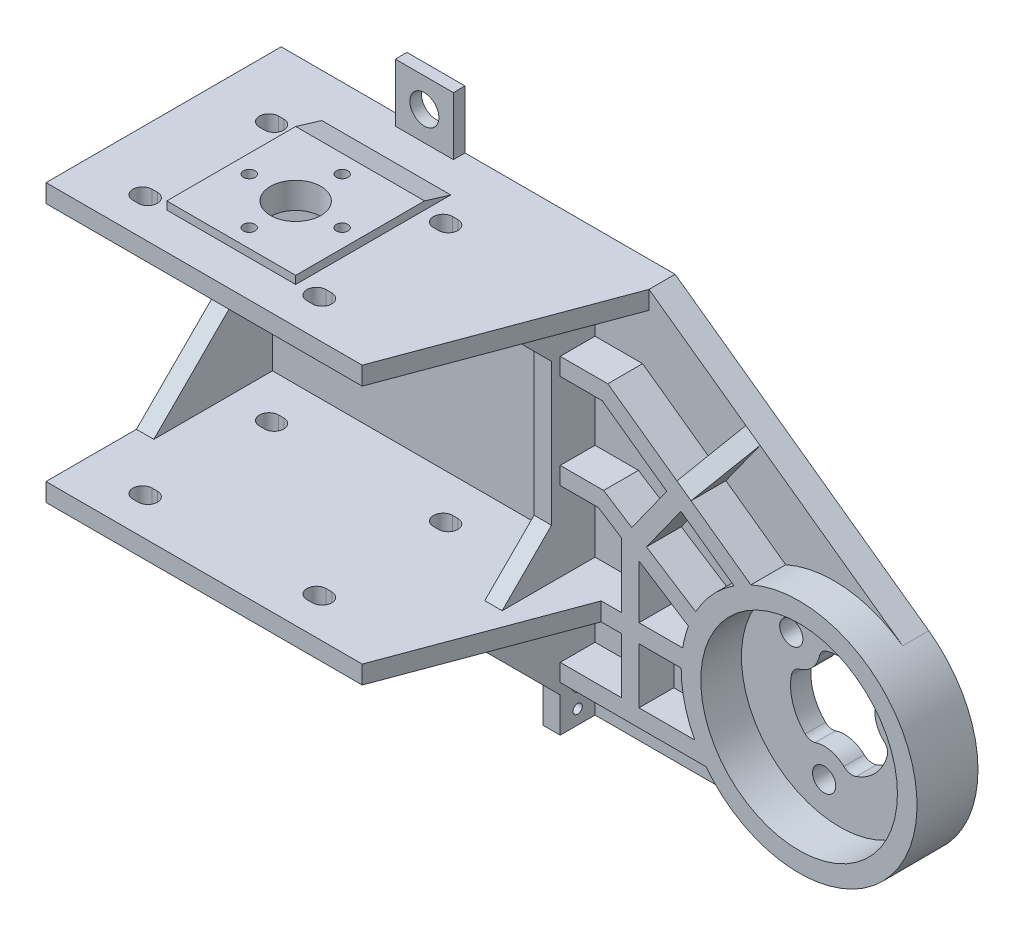
from build123d import *

# Parameters (mm, degrees)
SALIENTE_EXTRUIR1_DEPTH      = 3
SALIENTE_EXTRUIR1_DEPTH_BACK = 1.5
CROQUIS1_W                   = 121.063667988
CROQUIS1_H                   = 68.140715221
CROQUIS2_W                   = 67.847795658
CROQUIS2_H                   = 3.13
SALIENTE_EXTRUIR2_DEPTH      = 36
CORTAR_EXTRUIR1_REACH        = 128.318
SALIENTE_EXTRUIR3_DEPTH      = 3
CORTAR_EXTRUIR2_DEPTH        = 4.5
TALADRO_ROSCADO_M41_D        = 3.3
TALADRO_ROSCADO_M41_DEPTH    = 11.5
TALADRO_ROSCADO_M41_TIP      = 0.991420021
CROQUIS9_W                   = 10
CROQUIS9_H                   = 2
SALIENTE_EXTRUIR5_DEPTH      = 10
CROQUIS10_R                  = 2.5
CORTAR_EXTRUIR3_DEPTH        = 10
CROQUIS12_W                  = 22.2
CROQUIS12_H                  = 22.2
SALIENTE_EXTRUIR6_DEPTH      = 1.37
CROQUIS13_R                  = 1
CROQUIS13_R_2                = 4.35
CORTAR_EXTRUIR5_DEPTH        = 4.5
CROQUIS14_R                  = 2
CORTAR_EXTRUIR6_DEPTH        = 2
SALIENTE_EXTRUIR7_DEPTH      = 22.2
SALIENTE_EXTRUIR8_DEPTH      = 3
CROQUIS18_R                  = 20.310715222
CROQUIS18_R_2                = 16.935683112
SALIENTE_EXTRUIR9_DEPTH      = 6
CORTAR_EXTRUIR7_START        = -1
CROQUIS19_R                  = 16.935683112
CORTAR_EXTRUIR7_DEPTH        = 1
CROQUIS20_R                  = 8.480335769
CORTAR_EXTRUIR8_DEPTH        = 8
CROQUIS21_R                  = 2
CORTAR_EXTRUIR9_DEPTH        = 8
SALIENTE_EXTRUIR10_DEPTH     = 3
CROQUIS23_W                  = 6
CROQUIS23_H                  = 3.13
SALIENTE_EXTRUIR11_DEPTH     = 26
CROQUIS24_W                  = 3
CROQUIS24_H                  = 12.69645323
SALIENTE_EXTRUIR12_DEPTH     = 6
CORTAR_EXTRUIR10_DEPTH       = 3
CORTAR_EXTRUIR11_START       = -26
CORTAR_EXTRUIR11_DEPTH       = 26
CROQUIS27_R                  = 2.5
CORTAR_EXTRUIR12_DEPTH       = 26
CORTAR_EXTRUIR13_DEPTH       = 79
CROQUIS29_W                  = 6
CROQUIS29_H                  = 7.864261991
SALIENTE_EXTRUIR13_DEPTH     = 3
TALADRO_ROSCADO_M21_D        = 1.6
TALADRO_ROSCADO_M21_DEPTH    = 6
TALADRO_ROSCADO_M21_TIP      = 0.480688495
SALIENTE_EXTRUIR14_START     = -3.5
SALIENTE_EXTRUIR14_DEPTH     = 3.5
MATRIZC1_COUNT               = 3


with BuildPart() as part:
    # Croquis1 → Saliente-Extruir1 (new, two sides: drawn at the far end of the back side and taken through both)
    with BuildSketch(Plane.XY.offset(-SALIENTE_EXTRUIR1_DEPTH_BACK)):
        with Locations((-38.42328245, 9.597371481)):
            Rectangle(CROQUIS1_W, CROQUIS1_H)
    extrude(amount=SALIENTE_EXTRUIR1_DEPTH + SALIENTE_EXTRUIR1_DEPTH_BACK)

    # Croquis2 → Saliente-Extruir2 (add)
    with BuildSketch(Plane.XY.offset(3)):
        with Locations((-65.031218615, 42.102729092)):
            Rectangle(CROQUIS2_W, CROQUIS2_H)
        with Locations((-65.031218615, -2.477270908)):
            Rectangle(CROQUIS2_W, CROQUIS2_H)
    extrude(amount=SALIENTE_EXTRUIR2_DEPTH)

    # Cortar-Extruir1: up to this face of the body (flat: up to its plane)
    cortar_extruir1_end = Plane(part.part.faces().sort_by_distance((-65.031218615, -4.042270908, 21))[0])
    # Croquis3 → Cortar-Extruir1 (cut, up to the picked face)
    with BuildSketch(Plane(origin=(0, 43.667729092, 0), x_dir=(1, 0, 0), z_dir=(0, 1, 0)), mode=Mode.PRIVATE) as cortar_extruir1_sk1:
        Polygon((-44.494190287, -39), (-31.107320786, -3), (-31.107320786, -39), align=None)
    cortar_extruir1_tool1 = split(extrude(cortar_extruir1_sk1.sketch, amount=-CORTAR_EXTRUIR1_REACH, mode=Mode.PRIVATE), bisect_by=cortar_extruir1_end, keep=Keep.BOTH, mode=Mode.PRIVATE)
    add(cortar_extruir1_tool1.solids().sort_by(Axis((-35.569611, 43.667729, 27), (0, -1, 0)))[0], mode=Mode.SUBTRACT)

    # Croquis4 → Saliente-Extruir3 (add)
    with BuildSketch(Plane.ZY.offset(98.955116444)):
        Polygon((3, 40.537729092), (23.430715222, 40.537729092), (3, 20.107013871), align=None)
        Polygon((3, -4.042270908), (23.430715222, -4.042270908), (3, -24.472986129), align=None)
        Polygon((3, 19.518444314), (3, -0.912270908), (23.430715222, -0.912270908), align=None)
    extrude(amount=-SALIENTE_EXTRUIR3_DEPTH)

    # Croquis5 → Cortar-Extruir2 (cut)
    with BuildSketch(Plane.XY.offset(3)):
        Polygon((-31.107320786, 43.667729092), (21.055598778, 6.266945799), (21.055598778, -24.472986129), (40.051269615, -24.472986129), (40.051269615, 62.825880123), (-31.107320786, 62.825880123), align=None)
    extrude(amount=-CORTAR_EXTRUIR2_DEPTH, mode=Mode.SUBTRACT)

    # Taladro roscado M41
    with Locations(Plane(origin=(0, 43.667729092, 0), x_dir=(1, 0, 0), z_dir=(0, 1, 0))):
        with Locations((-88.355116444, -10.7), (-58.355116772, -10.695560483), (-58.355116772, -32.495560483), (-88.355116444, -32.5)):
            Hole(TALADRO_ROSCADO_M41_D / 2, depth=TALADRO_ROSCADO_M41_DEPTH)
            with Locations((0, 0, -(TALADRO_ROSCADO_M41_DEPTH + TALADRO_ROSCADO_M41_TIP / 2))):  # 118° drill point
                Cone(0, TALADRO_ROSCADO_M41_D / 2, TALADRO_ROSCADO_M41_TIP, mode=Mode.SUBTRACT)

    # Croquis9 → Saliente-Extruir5 (add)
    with BuildSketch(Plane(origin=(0, 43.667729092, 0), x_dir=(1, 0, 0), z_dir=(0, 1, 0))):
        with Locations((-72.293757509, 0.5)):
            Rectangle(CROQUIS9_W, CROQUIS9_H)
    extrude(amount=SALIENTE_EXTRUIR5_DEPTH)

    # Croquis10 → Cortar-Extruir3 (cut)
    with BuildSketch(Plane.XY.offset(0.5)):
        with Locations((-72.293757509, 48.667729092)):
            Circle(CROQUIS10_R)
    extrude(amount=-CORTAR_EXTRUIR3_DEPTH, mode=Mode.SUBTRACT)

    # Croquis12 → Saliente-Extruir6 (add)
    with BuildSketch(Plane(origin=(0, 43.667729092, 0), x_dir=(1, 0, 0), z_dir=(0, 1, 0))):
        with Locations((-73.355116444, -21.6)):
            Rectangle(CROQUIS12_W, CROQUIS12_H)
    extrude(amount=SALIENTE_EXTRUIR6_DEPTH)

    # Croquis13 → Cortar-Extruir5 (cut)
    with BuildSketch(Plane(origin=(0, 45.037729092, 0), x_dir=(1, 0, 0), z_dir=(0, 1, 0))):
        with Locations(Location((-73.355116444, -13.6, 0), (0, 0, 270))):
            Circle(CROQUIS13_R)
        with Locations(Location((-81.355116444, -21.6, 0), (0, 0, 270))):
            Circle(CROQUIS13_R)
        with Locations(Location((-73.355116444, -29.6, 0), (0, 0, 270))):
            Circle(CROQUIS13_R)
        with Locations(Location((-65.355116444, -21.6, 0), (0, 0, 270))):
            Circle(CROQUIS13_R)
        with Locations(Location((-73.355116444, -21.6, 0), (0, 0, 270))):
            Circle(CROQUIS13_R_2)
    extrude(amount=-CORTAR_EXTRUIR5_DEPTH, mode=Mode.SUBTRACT)

    # Croquis14 → Cortar-Extruir6 (cut)
    with BuildSketch(Plane.XZ.offset(-40.537729092)):
        with Locations(Location((-73.355116444, 29.6, 0), (0, 0, 270))):
            Circle(CROQUIS14_R)
        with Locations(Location((-81.355116444, 21.6, 0), (0, 0, 270))):
            Circle(CROQUIS14_R)
        with Locations(Location((-73.355116444, 13.6, 0), (0, 0, 270))):
            Circle(CROQUIS14_R)
        with Locations(Location((-65.355116444, 21.6, 0), (0, 0, 270))):
            Circle(CROQUIS14_R)
    extrude(amount=-CORTAR_EXTRUIR6_DEPTH, mode=Mode.SUBTRACT)

    # Croquis15 → Saliente-Extruir7 (add)
    with BuildSketch(Plane.ZY.offset(84.455116444)):
        Polygon((10.5, 45.037729092), (10.5, 43.667729092), (5.991039499, 43.667729092), align=None)
    extrude(amount=-SALIENTE_EXTRUIR7_DEPTH)

    # Croquis16 → Saliente-Extruir8 (add)
    with BuildSketch(Plane.ZY.offset(43.394190287)):
        Polygon((3, -0.912270908), (19, -0.912270908), (10.5, 7.587729092), (10.5, 32.037729092), (19, 40.537729092), (3, 40.537729092), align=None)
    extrude(amount=-SALIENTE_EXTRUIR8_DEPTH)

    # Croquis18 → Saliente-Extruir9 (add)
    with BuildSketch(Plane.XY.offset(3)):
        with Locations((0.744883556, -4.162270908)):
            Circle(CROQUIS18_R)
        with Locations((0.744883556, -4.162270908)):
            Circle(CROQUIS18_R_2, mode=Mode.SUBTRACT)
    extrude(amount=SALIENTE_EXTRUIR9_DEPTH)

    # Croquis19 → Cortar-Extruir7 (cut)
    with BuildSketch(Plane.XY.offset(3).offset(CORTAR_EXTRUIR7_START)):
        with Locations((0.744883556, -4.162270908)):
            Circle(CROQUIS19_R)
    extrude(amount=CORTAR_EXTRUIR7_DEPTH, mode=Mode.SUBTRACT)

    # Croquis20 → Cortar-Extruir8 (cut)
    with BuildSketch(Plane.XY.offset(3)):
        with Locations((0.744883556, -4.162270908)):
            Circle(CROQUIS20_R)
    extrude(amount=-CORTAR_EXTRUIR8_DEPTH, mode=Mode.SUBTRACT)

    # Croquis21 → Cortar-Extruir9 (cut)
    with BuildSketch(Plane.XY.offset(2)):
        with Locations((-1.940879918, -15.344250811)):
            Circle(CROQUIS21_R)
        with Locations((-7.596113367, 3.754658442)):
            Circle(CROQUIS21_R)
        with Locations((11.771643954, -0.897220354)):
            Circle(CROQUIS21_R)
    extrude(amount=-CORTAR_EXTRUIR9_DEPTH, mode=Mode.SUBTRACT)

    # Croquis22 → Saliente-Extruir10 (add)
    with BuildSketch(Plane.ZY.offset(43.394190287)):
        Polygon((23.430715222, -4.042270908), (3, -24.472986129), (3, -4.042270908), align=None)
    extrude(amount=-SALIENTE_EXTRUIR10_DEPTH)

    # Croquis23 → Saliente-Extruir11 (add)
    with BuildSketch(Plane.ZY.offset(43.394190287)):
        with Locations((6, -2.477270908)):
            Rectangle(CROQUIS23_W, CROQUIS23_H)
    extrude(amount=-SALIENTE_EXTRUIR11_DEPTH)

    # Croquis24 → Saliente-Extruir12 (add)
    with BuildSketch(Plane.XY.offset(3)):
        Polygon((-29.825513377, 10.217501063), (-29.825513377, -0.912270908), (-26.825513377, -0.912270908), (-26.825513377, 8.294080642), align=None)
        with BuildLine():
            Line((-33.802888263, 12.767555756), (-29.825513377, 10.217501063))
            Line((-29.825513377, 10.217501063), (-26.825513377, 8.294080642))
            Line((-26.825513377, 8.294080642), (-18.32024625, 2.841012484))
            ThreePointArc((-18.32024625, 2.841012484), (-17.744520742, 4.244100575), (-17.065703883, 5.600317269))
            Line((-17.065703883, 5.600317269), (-25.546147401, 11.037470016))
            Line((-25.546147401, 11.037470016), (-19.609965192, 19.316670819))
            Line((-19.609965192, 19.316670819), (-10.475906165, 12.767555756))
            ThreePointArc((-10.475906165, 12.767555756), (-9.052806806, 13.629030798), (-7.563981397, 14.371156082))
            Line((-7.563981397, 14.371156082), (-17.861872417, 21.754738014))
            Line((-17.861872417, 21.754738014), (-11.982245479, 29.955061109))
            Line((-11.982245479, 29.955061109), (-14.420312675, 31.703153884))
            Line((-14.420312675, 31.703153884), (-20.299939612, 23.50283079))
            Line((-20.299939612, 23.50283079), (-32.203573025, 32.037729092))
            Line((-32.203573025, 32.037729092), (-40.394190287, 32.037729092))
            Line((-40.394190287, 32.037729092), (-40.394190287, 29.037729092))
            Line((-40.394190287, 29.037729092), (-33.167937409, 29.037729092))
            Line((-33.167937409, 29.037729092), (-22.048032388, 21.064763594))
            Line((-22.048032388, 21.064763594), (-28.075061571, 12.658858401))
            Line((-28.075061571, 12.658858401), (-32.923763375, 15.767555756))
            Line((-32.923763375, 15.767555756), (-40.394190287, 15.767555756))
            Line((-40.394190287, 15.767555756), (-40.394190287, 12.767555756))
            Line((-40.394190287, 12.767555756), (-33.802888263, 12.767555756))
        make_face()
        with Locations((-28.325513377, -7.260497523)):
            Rectangle(CROQUIS24_W, CROQUIS24_H)
        with BuildLine():
            ThreePointArc((-17.235374345, -13.608724138), (-16.336366245, -15.151177042), (-15.305379831, -16.608724138))
            Line((-15.305379831, -16.608724138), (-40.394190287, -16.608724138))
            Line((-40.394190287, -16.608724138), (-40.394190287, -13.608724138))
            Line((-40.394190287, -13.608724138), (-17.235374345, -13.608724138))
        make_face()
    extrude(amount=SALIENTE_EXTRUIR12_DEPTH)

    # Croquis25 → Cortar-Extruir10 (cut)
    with BuildSketch(Plane(origin=(-22.099113918, 15.845051956, 0), x_dir=(0, 0, -1), z_dir=(0.8126890651104502, -0.5826975917660056, 0))):
        Polygon((-9, 7.271767657), (-3, 17.362125023), (-9, 17.362125023), align=None)
    extrude(amount=-CORTAR_EXTRUIR10_DEPTH, mode=Mode.SUBTRACT)

    # Croquis26 → Cortar-Extruir11 (cut)
    with BuildSketch(Plane.XY.offset(3).offset(CORTAR_EXTRUIR11_START)):
        with BuildLine():
            Line((0.744883556, -24.472986129), (0.744883556, -33.41431595))
            Line((0.744883556, -33.41431595), (41.986998714, -33.41431595))
            Line((41.986998714, -33.41431595), (41.986998714, 16.972104026))
            Line((41.986998714, 16.972104026), (26.413493121, 31.637771181))
            Line((26.413493121, 31.637771181), (12.579888403, 12.344025258))
            ThreePointArc((12.579888403, 12.344025258), (18.812846445, 5.115329529), (21.055598778, -4.162270908))
            ThreePointArc((21.055598778, -4.162270908), (15.10672802, -18.524115371), (0.744883556, -24.472986129))
        make_face()
    extrude(amount=CORTAR_EXTRUIR11_DEPTH, mode=Mode.SUBTRACT)

    # Croquis27 → Cortar-Extruir12 (cut)
    with BuildSketch(Plane.XY.offset(3)):
        with Locations((-84.793757509, -15.007639047)):
            Circle(CROQUIS27_R)
        with Locations((-59.793757509, -15.007639047)):
            Circle(CROQUIS27_R)
    extrude(amount=-CORTAR_EXTRUIR12_DEPTH, mode=Mode.SUBTRACT)

    # Croquis28 → Cortar-Extruir13 (cut)
    with BuildSketch(Plane(origin=(0, 43.667729092, 0), x_dir=(1, 0, 0), z_dir=(0, 1, 0))):
        with BuildLine():
            Line((-88.845173244, -30.85), (-87.917648807, -30.85))
            ThreePointArc((-87.917648807, -30.85), (-86.267648807, -32.5), (-87.917648807, -34.15))
            Line((-87.917648807, -34.15), (-88.845173244, -34.15))
            ThreePointArc((-88.845173244, -34.15), (-90.495173244, -32.5), (-88.845173244, -30.85))
        make_face()
        with BuildLine():
            Line((-88.845173244, -9.05), (-87.954030804, -9.05))
            ThreePointArc((-87.954030804, -9.05), (-86.304030804, -10.7), (-87.954030804, -12.35))
            Line((-87.954030804, -12.35), (-88.845173244, -12.35))
            ThreePointArc((-88.845173244, -12.35), (-90.495173244, -10.7), (-88.845173244, -9.05))
        make_face()
        with BuildLine():
            Line((-58.877624804, -30.845560483), (-57.895032809, -30.845560483))
            ThreePointArc((-57.895032809, -30.845560483), (-56.245032809, -32.495560483), (-57.895032809, -34.145560483))
            Line((-57.895032809, -34.145560483), (-58.877624804, -34.145560483))
            ThreePointArc((-58.877624804, -34.145560483), (-60.527624804, -32.495560483), (-58.877624804, -30.845560483))
        make_face()
        with BuildLine():
            Line((-58.877624804, -9.045560483), (-57.986482364, -9.045560483))
            ThreePointArc((-57.986482364, -9.045560483), (-56.336482364, -10.695560483), (-57.986482364, -12.345560483))
            Line((-57.986482364, -12.345560483), (-58.877624804, -12.345560483))
            ThreePointArc((-58.877624804, -12.345560483), (-60.527624804, -10.695560483), (-58.877624804, -9.045560483))
        make_face()
    extrude(amount=-CORTAR_EXTRUIR13_DEPTH, mode=Mode.SUBTRACT)

    # Croquis29 → Saliente-Extruir13 (add)
    with BuildSketch(Plane(origin=(-40.394190287, 0, 0), x_dir=(0, 0, -1), z_dir=(1, 0, 0))):
        with Locations((-6, -20.540855134)):
            Rectangle(CROQUIS29_W, CROQUIS29_H)
    extrude(amount=-SALIENTE_EXTRUIR13_DEPTH)

    # Taladro roscado M21
    with Locations(Plane.ZY.offset(43.394190287)):
        with Locations((6, -18.714920269), (6, -22.033440991)):
            Hole(TALADRO_ROSCADO_M21_D / 2, depth=TALADRO_ROSCADO_M21_DEPTH)
            with Locations((0, 0, -(TALADRO_ROSCADO_M21_DEPTH + TALADRO_ROSCADO_M21_TIP / 2))):  # 118° drill point
                Cone(0, TALADRO_ROSCADO_M21_D / 2, TALADRO_ROSCADO_M21_TIP, mode=Mode.SUBTRACT)

    # Croquis33 → Saliente-Extruir14 (add)
    with BuildSketch(Plane(origin=(0, 0, -1.5), x_dir=(-1, 0, 0), z_dir=(0, 0, -1)).offset(SALIENTE_EXTRUIR14_START)):
        with BuildLine():
            ThreePointArc((-8.435666892, -4.589134285), (-7.024564559, -2.388598456), (-6.923673704, 0.223563248))
            ThreePointArc((-6.923673704, 0.223563248), (-6.87122419, 1.357978889), (-6.236581871, 2.299721383))
            ThreePointArc((-6.236581871, 2.299721383), (-8.833247868, -1.613848356), (-8.948983527, -6.309091444))
            ThreePointArc((-8.948983527, -6.309091444), (-8.933097011, -5.377255161), (-8.435666892, -4.589134285))
        make_face()
    saliente_extruir14 = extrude(amount=SALIENTE_EXTRUIR14_DEPTH)

    # MatrizC1: Saliente-Extruir14 ×3 about axis
    matrizc1_axis = Axis((0.744883556, -4.162270908, 0), (0, 0, 1))
    for i in range(1, MATRIZC1_COUNT):
        add(saliente_extruir14.rotate(matrizc1_axis, i * 360 / MATRIZC1_COUNT))


solid = part.part
